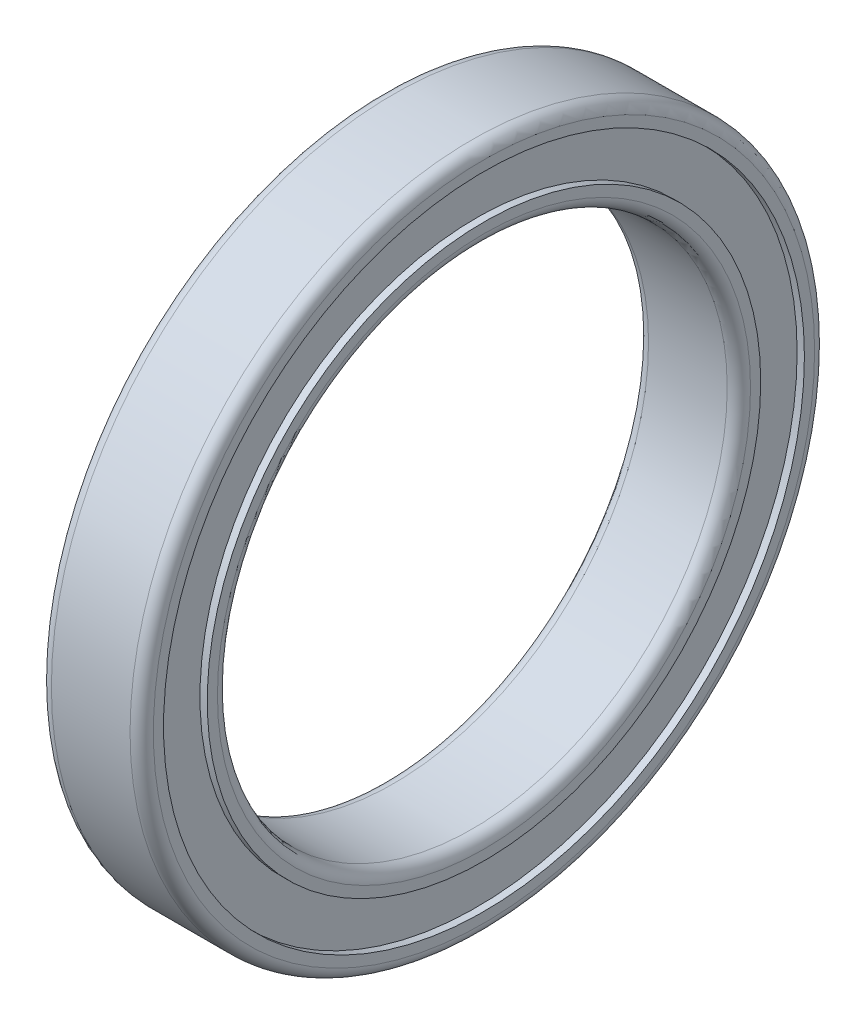
from build123d import *

# Parameters (mm, degrees)
FILLET_1_R = 0.8


with BuildPart() as part:
    # Эскиз1 → Повернуть1 (revolve)
    with BuildSketch(Plane.XY, mode=Mode.PRIVATE) as revolve_1_sk:
        Polygon((3.5, 17.5), (-3.5, 17.5), (-3.5, 19), (-3, 19), (-3, 22), (-3.5, 22), (-3.5, 23.5), (3.5, 23.5), (3.5, 22), (3, 22), (3, 19), (3.5, 19), align=None)
    revolve(revolve_1_sk.sketch.rotate(Axis((0, 0, 0), (-1, 0, 0)), 90), axis=Axis((0, 0, 0), (-1, 0, 0)))

    # Скругление1
    fillet_1_edges = [part.edges().sort_by_distance(p)[0] for p in [
        (-3.5, 0, 23.5),
        (3.5, 0, 23.5),
        (3.5, 0, 17.5),
        (-3.5, 0, 17.5),
    ]]
    fillet(fillet_1_edges, radius=FILLET_1_R)


solid = part.part
